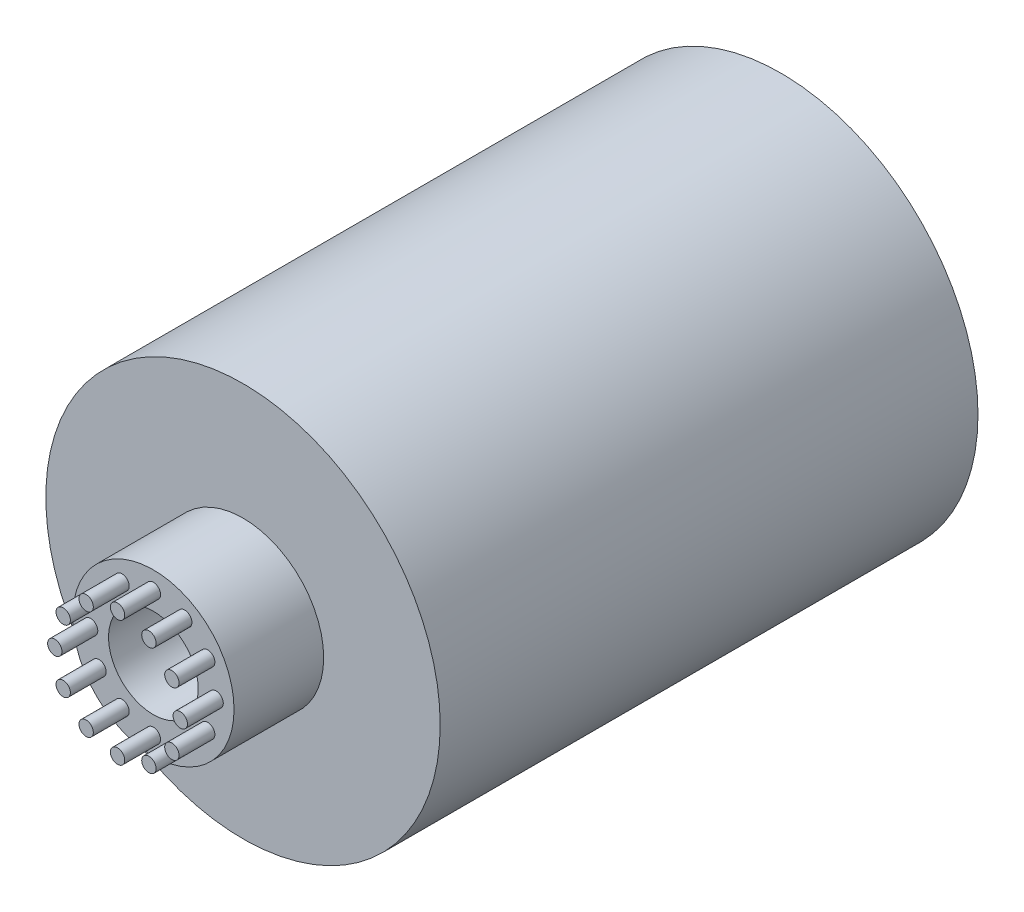
from build123d import *

# Parameters (mm, degrees)
SKETCH2_R           = 11
BOSS_EXTRUDE1_DEPTH = 30
SKETCH3_R           = 4.5
BOSS_EXTRUDE2_DEPTH = 5
BOSS_EXTRUDE3_START = 4
SKETCH4_R           = 4.5
BOSS_EXTRUDE3_DEPTH = 4
SKETCH5_R           = 2.5
CUT_EXTRUDE1_DEPTH  = 42.98809355
SKETCH6_R           = 0.4
BOSS_EXTRUDE4_DEPTH = 2
CIRPATTERN1_COUNT   = 12


with BuildPart() as part:
    # Sketch2 → Boss-Extrude1 (new body)
    with BuildSketch(Plane.XY):
        Circle(SKETCH2_R)
    extrude(amount=BOSS_EXTRUDE1_DEPTH)

    # Sketch3 → Boss-Extrude2 (add)
    with BuildSketch(Plane.XY.offset(30)):
        Circle(SKETCH3_R)
    extrude(amount=BOSS_EXTRUDE2_DEPTH)

    # Sketch4 → Boss-Extrude3 (add)
    with BuildSketch(Plane(origin=(0, 0, 0), x_dir=(-1, 0, 0), z_dir=(0, 0, -1)).offset(BOSS_EXTRUDE3_START)):
        with Locations(Location((0, 0, 0), (0, 0, 180))):
            Circle(SKETCH4_R)
    extrude(amount=-BOSS_EXTRUDE3_DEPTH)

    # Sketch5 → Cut-Extrude1 (cut, through all)
    with BuildSketch(Plane.XY.offset(35)):
        Circle(SKETCH5_R)
    extrude(amount=-CUT_EXTRUDE1_DEPTH, mode=Mode.SUBTRACT)

    # Sketch6 → Boss-Extrude4 (add)
    with BuildSketch(Plane.XY.offset(35)):
        with Locations((0, 3.5)):
            Circle(SKETCH6_R)
    boss_extrude4 = extrude(amount=BOSS_EXTRUDE4_DEPTH)

    # CirPattern1: Boss-Extrude4 ×12 about axis
    cirpattern1_axis = Axis((0, 0, 0), (0, 0, 1))
    for i in range(1, CIRPATTERN1_COUNT):
        add(boss_extrude4.rotate(cirpattern1_axis, i * 360 / CIRPATTERN1_COUNT))


solid = part.part
